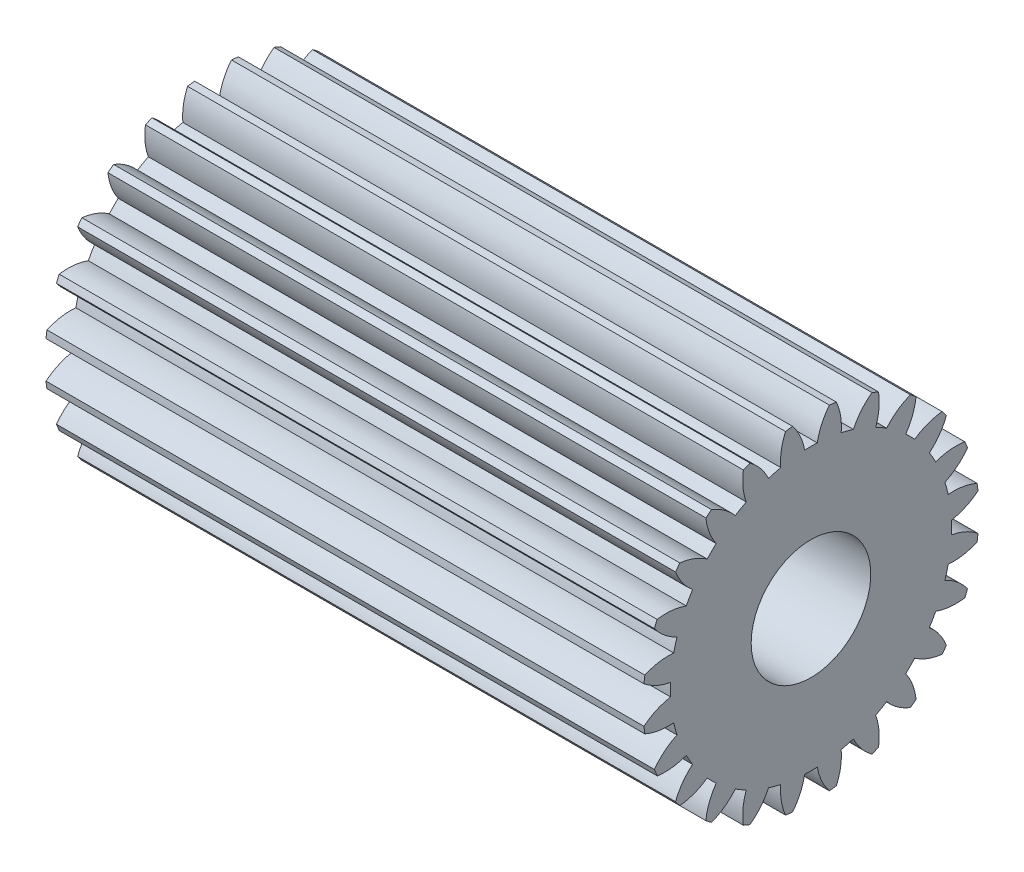
from build123d import *

# Parameters (mm, degrees)
SKETCH1_R           = 5
BOSS_EXTRUDE1_DEPTH = 50


with BuildPart() as part:
    # Sketch1 → Boss-Extrude1 (new body)
    with BuildSketch(Plane(origin=(-24.036200878, 0, 0), x_dir=(0, 0, -1), z_dir=(1, 0, 0))):
        with BuildLine():
            ThreePointArc((-20.45966069, 14.943685115), (-19.408744482, 14.297932757), (-18.23009109, 13.93434348))
            ThreePointArc((-18.23009109, 13.93434348), (-18.241981361, 13.405873993), (-18.23009109, 12.877404505))
            ThreePointArc((-18.23009109, 12.877404505), (-19.408744482, 12.513815228), (-20.45966069, 11.86806287))
            ThreePointArc((-20.45966069, 11.86806287), (-20.423843041, 11.571709606), (-20.381738364, 11.276184046))
            ThreePointArc((-20.381738364, 11.276184046), (-19.19949825, 10.924432295), (-17.966902668, 10.878289967))
            ThreePointArc((-17.966902668, 10.878289967), (-17.84160982, 10.364750213), (-17.693346732, 9.857365315))
            ThreePointArc((-17.693346732, 9.857365315), (-18.737734654, 9.201107096), (-19.585708752, 8.305361087))
            ThreePointArc((-19.585708752, 8.305361087), (-19.465117023, 8.00599622), (-19.337681897, 7.709479816))
            ThreePointArc((-19.337681897, 7.709479816), (-18.111776725, 7.700053845), (-16.921717322, 7.994487129))
            ThreePointArc((-16.921717322, 7.994487129), (-16.667779856, 7.530873993), (-16.393247835, 7.079151127))
            ThreePointArc((-16.393247835, 7.079151127), (-17.232196976, 6.17494688), (-17.81944093, 5.09025083))
            ThreePointArc((-17.81944093, 5.09025083), (-17.640245305, 4.851510199), (-17.456018805, 4.616629895))
            ThreePointArc((-17.456018805, 4.616629895), (-16.256292957, 4.903124001), (-15.165762707, 5.479461363))
            ThreePointArc((-15.165762707, 5.479461363), (-14.80048604, 5.097369314), (-14.418393991, 4.732092647))
            ThreePointArc((-14.418393991, 4.732092647), (-14.994731353, 3.641562397), (-15.281225459, 2.441836549))
            ThreePointArc((-15.281225459, 2.441836549), (-15.046345155, 2.257610049), (-14.807604524, 2.078414424))
            ThreePointArc((-14.807604524, 2.078414424), (-13.722908474, 2.665658378), (-12.818704227, 3.504607519))
            ThreePointArc((-12.818704227, 3.504607519), (-12.366981361, 3.230075498), (-11.903368225, 2.976138032))
            ThreePointArc((-11.903368225, 2.976138032), (-12.17781737, 1.773599613), (-12.144037527, 0.540603301))
            ThreePointArc((-12.144037527, 0.540603301), (-11.869479248, 0.423445663), (-11.592494266, 0.312146602))
            ThreePointArc((-11.592494266, 0.312146602), (-10.696748258, 1.1601207), (-10.040490039, 2.204508622))
            ThreePointArc((-10.040490039, 2.204508622), (-9.533105141, 2.056245534), (-9.019565387, 1.930952686))
            ThreePointArc((-9.019565387, 1.930952686), (-8.973423058, 0.698357104), (-8.621671308, -0.48388301))
            ThreePointArc((-8.621671308, -0.48388301), (-8.326145748, -0.525987687), (-8.029792484, -0.561805336))
            ThreePointArc((-8.029792484, -0.561805336), (-7.384040126, 0.489110872), (-7.020450848, 1.667764264))
            ThreePointArc((-7.020450848, 1.667764264), (-6.491981361, 1.655873993), (-5.963511874, 1.667764264))
            ThreePointArc((-5.963511874, 1.667764264), (-5.599922596, 0.489110872), (-4.954170239, -0.561805336))
            ThreePointArc((-4.954170239, -0.561805336), (-4.657816975, -0.525987687), (-4.362291414, -0.48388301))
            ThreePointArc((-4.362291414, -0.48388301), (-4.010539664, 0.698357104), (-3.964397336, 1.930952686))
            ThreePointArc((-3.964397336, 1.930952686), (-3.450857581, 2.056245534), (-2.943472684, 2.204508622))
            ThreePointArc((-2.943472684, 2.204508622), (-2.287214465, 1.1601207), (-1.391468456, 0.312146602))
            ThreePointArc((-1.391468456, 0.312146602), (-1.114483475, 0.423445663), (-0.839925195, 0.540603301))
            ThreePointArc((-0.839925195, 0.540603301), (-0.806145353, 1.773599613), (-1.080594498, 2.976138032))
            ThreePointArc((-1.080594498, 2.976138032), (-0.616981361, 3.230075498), (-0.165258496, 3.504607519))
            ThreePointArc((-0.165258496, 3.504607519), (0.738945751, 2.665658378), (1.823641801, 2.078414424))
            ThreePointArc((1.823641801, 2.078414424), (2.062382432, 2.257610049), (2.297262736, 2.441836549))
            ThreePointArc((2.297262736, 2.441836549), (2.01076863, 3.641562397), (1.434431268, 4.732092647))
            ThreePointArc((1.434431268, 4.732092647), (1.816523318, 5.097369314), (2.181799984, 5.479461363))
            ThreePointArc((2.181799984, 5.479461363), (3.272330234, 4.903124001), (4.472056082, 4.616629895))
            ThreePointArc((4.472056082, 4.616629895), (4.656282582, 4.851510199), (4.835478208, 5.09025083))
            ThreePointArc((4.835478208, 5.09025083), (4.248234253, 6.17494688), (3.409285113, 7.079151127))
            ThreePointArc((3.409285113, 7.079151127), (3.683817133, 7.530873993), (3.9377546, 7.994487129))
            ThreePointArc((3.9377546, 7.994487129), (5.140293018, 7.720037984), (6.37328933, 7.753817827))
            ThreePointArc((6.37328933, 7.753817827), (6.490446969, 8.028376106), (6.601746029, 8.305361087))
            ThreePointArc((6.601746029, 8.305361087), (5.753771931, 9.201107096), (4.709384009, 9.857365315))
            ThreePointArc((4.709384009, 9.857365315), (4.857647098, 10.364750213), (4.982939945, 10.878289967))
            ThreePointArc((4.982939945, 10.878289967), (6.215535527, 10.924432295), (7.397775641, 11.276184046))
            ThreePointArc((7.397775641, 11.276184046), (7.439880319, 11.571709606), (7.475697967, 11.86806287))
            ThreePointArc((7.475697967, 11.86806287), (6.424781759, 12.513815228), (5.246128367, 12.877404505))
            ThreePointArc((5.246128367, 12.877404505), (5.258018639, 13.405873993), (5.246128367, 13.93434348))
            ThreePointArc((5.246128367, 13.93434348), (6.424781759, 14.297932757), (7.475697967, 14.943685115))
            ThreePointArc((7.475697967, 14.943685115), (7.439880319, 15.240038379), (7.397775641, 15.535563939))
            ThreePointArc((7.397775641, 15.535563939), (6.215535527, 15.88731569), (4.982939945, 15.933458018))
            ThreePointArc((4.982939945, 15.933458018), (4.857647098, 16.446997772), (4.709384009, 16.95438267))
            ThreePointArc((4.709384009, 16.95438267), (5.753771931, 17.610640889), (6.601746029, 18.506386898))
            ThreePointArc((6.601746029, 18.506386898), (6.490446969, 18.783371879), (6.37328933, 19.057930158))
            ThreePointArc((6.37328933, 19.057930158), (5.140293018, 19.091710001), (3.9377546, 18.817260856))
            ThreePointArc((3.9377546, 18.817260856), (3.683817133, 19.280873993), (3.409285113, 19.732596858))
            ThreePointArc((3.409285113, 19.732596858), (4.248234253, 20.636801105), (4.835478208, 21.721497155))
            ThreePointArc((4.835478208, 21.721497155), (4.656282582, 21.960237786), (4.472056082, 22.19511809))
            ThreePointArc((4.472056082, 22.19511809), (3.272330234, 21.908623984), (2.181799984, 21.332286622))
            ThreePointArc((2.181799984, 21.332286622), (1.816523318, 21.714378671), (1.434431268, 22.079655338))
            ThreePointArc((1.434431268, 22.079655338), (2.01076863, 23.170185588), (2.297262736, 24.369911436))
            ThreePointArc((2.297262736, 24.369911436), (2.062382432, 24.554137936), (1.823641801, 24.733333561))
            ThreePointArc((1.823641801, 24.733333561), (0.738945751, 24.146089607), (-0.165258496, 23.307140466))
            ThreePointArc((-0.165258496, 23.307140466), (-0.616981361, 23.581672487), (-1.080594498, 23.835609953))
            ThreePointArc((-1.080594498, 23.835609953), (-0.806145353, 25.038148372), (-0.839925195, 26.271144684))
            ThreePointArc((-0.839925195, 26.271144684), (-1.114483475, 26.388302322), (-1.391468456, 26.499601383))
            ThreePointArc((-1.391468456, 26.499601383), (-2.287214465, 25.651627285), (-2.943472684, 24.607239363))
            ThreePointArc((-2.943472684, 24.607239363), (-3.450857581, 24.755502451), (-3.964397336, 24.880795299))
            ThreePointArc((-3.964397336, 24.880795299), (-4.010539664, 26.113390881), (-4.362291414, 27.295630995))
            ThreePointArc((-4.362291414, 27.295630995), (-4.657816975, 27.337735672), (-4.954170239, 27.373553321))
            ThreePointArc((-4.954170239, 27.373553321), (-5.599922596, 26.322637113), (-5.963511874, 25.143983721))
            ThreePointArc((-5.963511874, 25.143983721), (-6.491981361, 25.155873993), (-7.020450848, 25.143983721))
            ThreePointArc((-7.020450848, 25.143983721), (-7.384040126, 26.322637113), (-8.029792484, 27.373553321))
            ThreePointArc((-8.029792484, 27.373553321), (-8.326145748, 27.337735672), (-8.621671308, 27.295630995))
            ThreePointArc((-8.621671308, 27.295630995), (-8.973423058, 26.113390881), (-9.019565387, 24.880795299))
            ThreePointArc((-9.019565387, 24.880795299), (-9.533105141, 24.755502451), (-10.040490039, 24.607239363))
            ThreePointArc((-10.040490039, 24.607239363), (-10.696748258, 25.651627285), (-11.592494266, 26.499601383))
            ThreePointArc((-11.592494266, 26.499601383), (-11.869479248, 26.388302322), (-12.144037527, 26.271144684))
            ThreePointArc((-12.144037527, 26.271144684), (-12.17781737, 25.038148372), (-11.903368225, 23.835609953))
            ThreePointArc((-11.903368225, 23.835609953), (-12.366981361, 23.581672487), (-12.818704227, 23.307140466))
            ThreePointArc((-12.818704227, 23.307140466), (-13.722908474, 24.146089607), (-14.807604524, 24.733333561))
            ThreePointArc((-14.807604524, 24.733333561), (-15.046345155, 24.554137936), (-15.281225459, 24.369911436))
            ThreePointArc((-15.281225459, 24.369911436), (-14.994731353, 23.170185588), (-14.418393991, 22.079655338))
            ThreePointArc((-14.418393991, 22.079655338), (-14.80048604, 21.714378671), (-15.165762707, 21.332286622))
            ThreePointArc((-15.165762707, 21.332286622), (-16.256292957, 21.908623984), (-17.456018805, 22.19511809))
            ThreePointArc((-17.456018805, 22.19511809), (-17.640245305, 21.960237786), (-17.81944093, 21.721497155))
            ThreePointArc((-17.81944093, 21.721497155), (-17.232196976, 20.636801105), (-16.393247835, 19.732596858))
            ThreePointArc((-16.393247835, 19.732596858), (-16.667779856, 19.280873993), (-16.921717322, 18.817260856))
            ThreePointArc((-16.921717322, 18.817260856), (-18.124255741, 19.091710001), (-19.357252053, 19.057930158))
            ThreePointArc((-19.357252053, 19.057930158), (-19.474409691, 18.783371879), (-19.585708752, 18.506386898))
            ThreePointArc((-19.585708752, 18.506386898), (-18.737734654, 17.610640889), (-17.693346732, 16.95438267))
            ThreePointArc((-17.693346732, 16.95438267), (-17.84160982, 16.446997772), (-17.966902668, 15.933458018))
            ThreePointArc((-17.966902668, 15.933458018), (-19.19949825, 15.88731569), (-20.381738364, 15.535563939))
            ThreePointArc((-20.381738364, 15.535563939), (-20.423843041, 15.240038379), (-20.45966069, 14.943685115))
        make_face()
        with Locations(Location((-6.491981361, 13.405873993, 0), (0, 0, 180))):
            Circle(SKETCH1_R, mode=Mode.SUBTRACT)
    extrude(amount=-BOSS_EXTRUDE1_DEPTH)


solid = part.part
